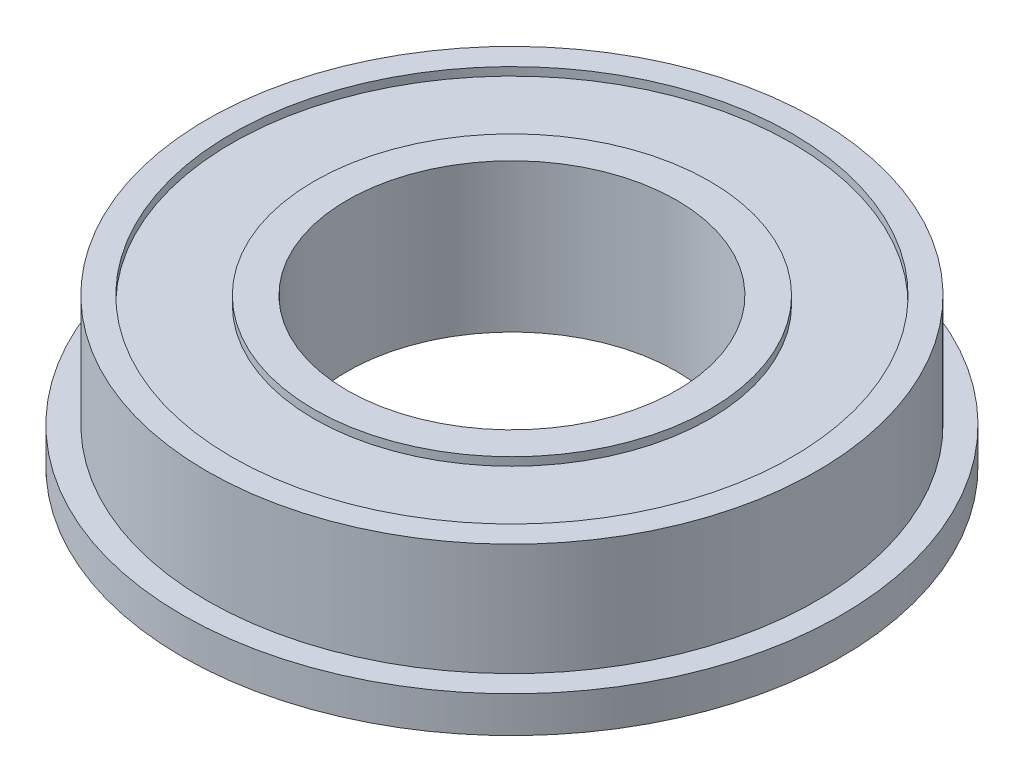
from build123d import *

# Parameters (mm, degrees)
SKETCH_1_R          = 20
EXTRUDE_1_DEPTH     = 2.2
SKETCH_2_R          = 18.5
EXTRUDE_2_DEPTH     = 6.8
SKETCH_3_R          = 10
CUT_EXTRUDE_1_DEPTH = 9
SKETCH_4_R          = 17
SKETCH_4_R_2        = 12
CUT_EXTRUDE_2_DEPTH = 0.5
CUT_EXTRUDE_START   = -0.5
SKETCH_5_R          = 17
SKETCH_5_R_2        = 12
CUT_EXTRUDE_3_DEPTH = 0.5


with BuildPart() as part:
    # 草图1 → 凸台-拉伸1 (new body)
    with BuildSketch(Plane(origin=(0, 0, 0), x_dir=(1, 0, 0), z_dir=(0, 1, 0))):
        with Locations(Location((0, 0, 0), (0, 0, 270))):
            Circle(SKETCH_1_R)
    extrude(amount=EXTRUDE_1_DEPTH)

    # 草图2 → 凸台-拉伸2 (add)
    with BuildSketch(Plane(origin=(0, 2.2, 0), x_dir=(1, 0, 0), z_dir=(0, 1, 0))):
        with Locations(Location((0, 0, 0), (0, 0, 270))):
            Circle(SKETCH_2_R)
    extrude(amount=EXTRUDE_2_DEPTH)

    # 草图3 → 切除-拉伸1 (cut)
    with BuildSketch(Plane(origin=(0, 9, 0), x_dir=(1, 0, 0), z_dir=(0, 1, 0))):
        with Locations(Location((0, 0, 0), (0, 0, 270))):
            Circle(SKETCH_3_R)
    extrude(amount=-CUT_EXTRUDE_1_DEPTH, mode=Mode.SUBTRACT)

    # 草图4 → 切除-拉伸2 (cut)
    with BuildSketch(Plane.XZ):
        with Locations(Location((0, 0, 0), (0, 0, 270))):
            Circle(SKETCH_4_R)
        with Locations(Location((0, 0, 0), (0, 0, 270))):
            Circle(SKETCH_4_R_2, mode=Mode.SUBTRACT)
    extrude(amount=-CUT_EXTRUDE_2_DEPTH, mode=Mode.SUBTRACT)

    # 草图5 → 切除-拉伸3 (cut)
    with BuildSketch(Plane(origin=(0, 9, 0), x_dir=(1, 0, 0), z_dir=(0, 1, 0)).offset(CUT_EXTRUDE_START)):
        with Locations(Location((0, 0, 0), (0, 0, 90))):
            Circle(SKETCH_5_R)
        with Locations(Location((0, 0, 0), (0, 0, 90))):
            Circle(SKETCH_5_R_2, mode=Mode.SUBTRACT)
    extrude(amount=CUT_EXTRUDE_3_DEPTH, mode=Mode.SUBTRACT)


solid = part.part
